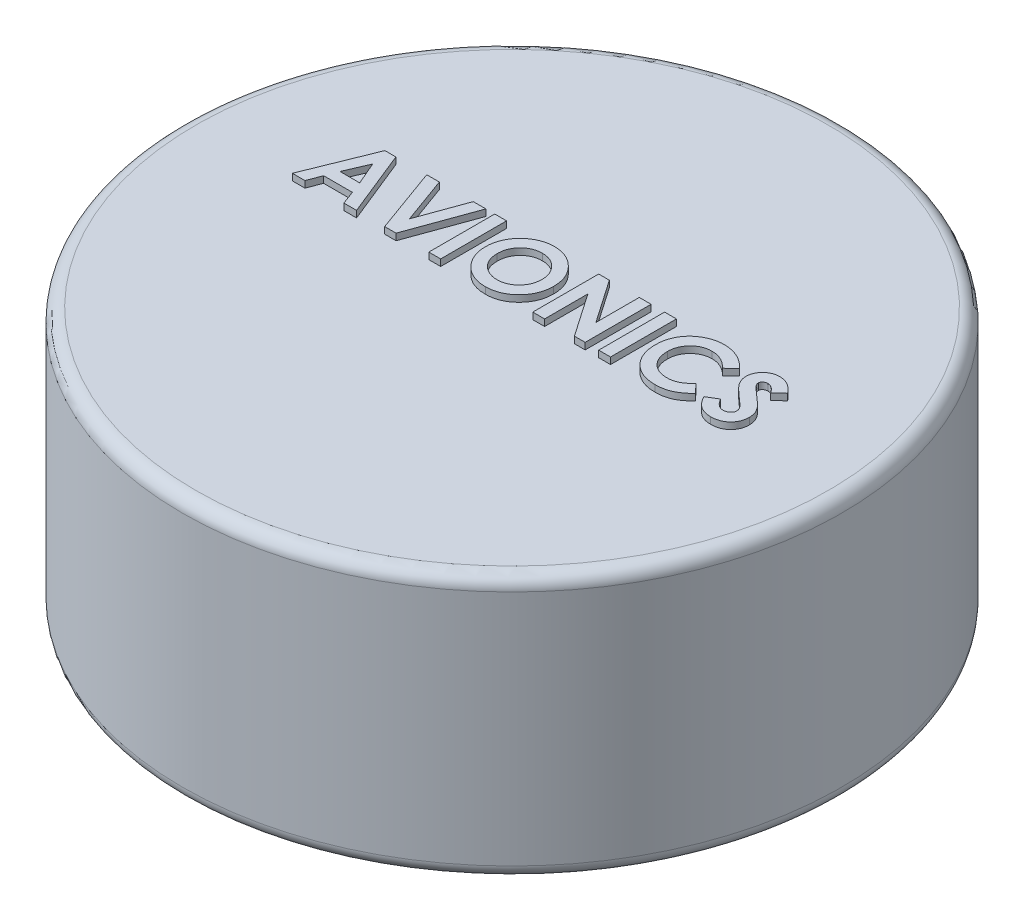
from build123d import *

# Parameters (mm, degrees)
SKETCH1_R           = 63.5
BOSS_EXTRUDE1_DEPTH = 50.8
SKETCH2_W           = 2.27948718
SKETCH2_H           = 12.7
BOSS_EXTRUDE2_DEPTH = 1.27
FILLET1_R           = 2.54
SKETCH3_W           = 6.35
SKETCH3_H           = 1.13974359
CUT_EXTRUDE2_DEPTH  = 0.635


with BuildPart() as part:
    # Sketch1 → Boss-Extrude1 (new body)
    with BuildSketch(Plane(origin=(0, 0, 0), x_dir=(1, 0, 0), z_dir=(0, 1, 0))):
        with Locations(Location((0, 0, 0), (0, 0, 270))):
            Circle(SKETCH1_R)
    extrude(amount=BOSS_EXTRUDE1_DEPTH)

    # Sketch2 → Boss-Extrude2 (add)
    # profile 1 of 8: a face of its own
    with BuildSketch(Plane(origin=(0, 50.8, 0), x_dir=(1, 0, 0), z_dir=(0, 1, 0))):
        with BuildLine():
            Line((42.089102564, 11.003104968), (40.384575321, 9.443589744))
            add(Edge.make_bspline(
                [(40.384575321, 9.443589744), (40.311560682, 9.546584482), (40.171382759, 9.744320015), (39.944168966, 10.009092556), (39.717981161, 10.234963237), (39.490723849, 10.420988475), (39.260382709, 10.566038029), (39.02735758, 10.668734715), (38.792969546, 10.734019974), (38.635496969, 10.742149559), (38.557932692, 10.746153846)],
                knots=[0, 0, 0, 0, 1.299362458, 2.494594718, 3.587462134, 4.587049575, 5.512617175, 6.380583204, 7.202344345, 8, 8, 8, 8], degree=3))
            add(Edge.make_bspline(
                [(38.557932692, 10.746153846), (38.48558296, 10.743616546), (38.345894636, 10.738717687), (38.146758566, 10.690023387), (37.969962727, 10.605984176), (37.815679665, 10.496095839), (37.693464716, 10.363705868), (37.595885558, 10.224862829), (37.540940292, 10.071611514), (37.533708414, 9.966352329), (37.530128205, 9.914242788)],
                knots=[0, 0, 0, 0, 1.185010067, 2.2879431, 3.333075148, 4.379039566, 5.372662701, 6.27520591, 7.14612461, 8, 8, 8, 8], degree=3))
            add(Edge.make_bspline(
                [(37.530128205, 9.914242788), (37.53237174, 9.861381805), (37.536889909, 9.754927131), (37.580529263, 9.598904547), (37.646306232, 9.446452321), (37.709158811, 9.353647397), (37.741286058, 9.306209936)],
                knots=[0, 0, 0, 0, 0.967525499, 1.948461899, 2.951351359, 4, 4, 4, 4], degree=3))
            add(Edge.make_bspline(
                [(37.741286058, 9.306209936), (37.770493201, 9.269337294), (37.837724186, 9.184461342), (37.965919906, 9.050031065), (38.126906807, 8.885342209), (38.326880004, 8.696057941), (38.55753806, 8.475370858), (38.829572273, 8.231956253), (39.135152312, 7.95827586), (39.352351524, 7.767694745), (39.466165865, 7.667828526)],
                knots=[0, 0, 0, 0, 0.473873513, 1.090794244, 1.870441696, 2.795289791, 3.865433203, 5.087734844, 6.473946851, 8, 8, 8, 8], degree=3))
            add(Edge.make_bspline(
                [(39.466165865, 7.667828526), (39.572996997, 7.57537157), (39.77574029, 7.399907476), (40.064203735, 7.150864368), (40.31771506, 6.926806355), (40.539967346, 6.731096071), (40.727591466, 6.561680065), (40.881376193, 6.417748531), (41.003199745, 6.302103551), (41.072449301, 6.232253913), (41.102003205, 6.20244391)],
                knots=[0, 0, 0, 0, 1.543621617, 2.929473131, 4.163658386, 5.240097082, 6.164993805, 6.925417477, 7.541396219, 8, 8, 8, 8], degree=3))
            add(Edge.make_bspline(
                [(41.102003205, 6.20244391), (41.214124555, 6.081104597), (41.429661163, 5.847847825), (41.709782773, 5.486373187), (41.940331919, 5.133500233), (42.11868911, 4.782589088), (42.253391634, 4.428576801), (42.348358699, 4.062781241), (42.405235105, 3.681380074), (42.411549714, 3.421120337), (42.41474359, 3.289483173)],
                knots=[0, 0, 0, 0, 1.206664779, 2.319633467, 3.337109185, 4.282041471, 5.190008762, 6.099243693, 7.03861361, 8, 8, 8, 8], degree=3))
            add(Edge.make_bspline(
                [(42.41474359, 3.289483173), (42.412470271, 3.161218901), (42.408009935, 2.909559625), (42.353379369, 2.541293762), (42.275479389, 2.188847347), (42.155032354, 1.856055497), (42.008232221, 1.537455535), (41.824197052, 1.238010235), (41.608072981, 0.954689087), (41.360361612, 0.692556805), (41.086363423, 0.454689928), (40.792474325, 0.242935216), (40.475820522, 0.068104729), (40.139107455, -0.075855707), (39.782515359, -0.18673596), (39.406469042, -0.2686868), (39.010393315, -0.317872403), (38.739551026, -0.323014174), (38.601181891, -0.325641026)],
                knots=[0, 0, 0, 0, 1.043214005, 2.046824704, 3.02475056, 3.976699089, 4.921714032, 5.875962561, 6.831408892, 7.817874052, 8.806269674, 9.781291748, 10.760897367, 11.74438705, 12.757449933, 13.795994037, 14.874007457, 16, 16, 16, 16], degree=3))
            add(Edge.make_bspline(
                [(38.601181891, -0.325641026), (38.492563299, -0.323714059), (38.277436193, -0.319897561), (37.960371362, -0.28873903), (37.654209426, -0.238452477), (37.359295248, -0.166376823), (37.074300188, -0.075047195), (36.799212542, 0.036508447), (36.535931331, 0.170019174), (36.282464445, 0.322739475), (36.040044045, 0.50006786), (35.805604821, 0.698378911), (35.581475446, 0.920722738), (35.366579472, 1.166573507), (35.162291863, 1.43662741), (34.961925553, 1.727123445), (34.774385424, 2.043452825), (34.658533543, 2.265360444), (34.599358974, 2.378705929)],
                knots=[0, 0, 0, 0, 1.016823716, 2.013894106, 2.979844003, 3.91962641, 4.853723003, 5.779685073, 6.695824784, 7.614987388, 8.547259901, 9.504950863, 10.487499108, 11.500346958, 12.559593716, 13.656357062, 14.802919212, 16, 16, 16, 16], degree=3))
            Line((34.599358974, 2.378705929), (36.604086538, 3.582051282))
            add(Edge.make_bspline(
                [(36.604086538, 3.582051282), (36.67810508, 3.453389346), (36.82000495, 3.206733419), (37.060467545, 2.87531992), (37.306809199, 2.591519116), (37.564725108, 2.360347206), (37.831079112, 2.178713124), (38.107157762, 2.048904809), (38.393155027, 1.968553608), (38.587963371, 1.95874087), (38.685136218, 1.953846154)],
                knots=[0, 0, 0, 0, 1.283663364, 2.460892379, 3.537111102, 4.529833553, 5.449777664, 6.316464042, 7.160231139, 8, 8, 8, 8], degree=3))
            add(Edge.make_bspline(
                [(38.685136218, 1.953846154), (38.783974915, 1.957843445), (38.975736382, 1.965598771), (39.249451337, 2.037232385), (39.500403572, 2.149702414), (39.71732483, 2.310181636), (39.901000075, 2.495399049), (40.036562949, 2.70146189), (40.12172446, 2.92441691), (40.130728097, 3.079296132), (40.13525641, 3.157191506)],
                knots=[0, 0, 0, 0, 1.13588714, 2.203786484, 3.234766741, 4.283437687, 5.291419208, 6.222934724, 7.106237994, 8, 8, 8, 8], degree=3))
            add(Edge.make_bspline(
                [(40.13525641, 3.157191506), (40.131074698, 3.229660476), (40.122579951, 3.37687425), (40.060010259, 3.59575746), (39.962194746, 3.814541127), (39.846472097, 3.993993409), (39.728709811, 4.14424394), (39.616102504, 4.274429229), (39.478976592, 4.418261182), (39.317679767, 4.575920729), (39.134343179, 4.748795786), (38.928812393, 4.936869426), (38.698733862, 5.138484943), (38.536113902, 5.275823442), (38.451081731, 5.347636218)],
                knots=[0, 0, 0, 0, 0.916159276, 1.861089862, 2.860218735, 3.940849679, 4.552606315, 5.27541173, 6.11797699, 7.06649574, 8.129236253, 9.306560635, 10.591630461, 12, 12, 12, 12], degree=3))
            add(Edge.make_bspline(
                [(38.451081731, 5.347636218), (38.289432189, 5.484407231), (37.97917779, 5.746912204), (37.540748961, 6.134623785), (37.145685331, 6.496975782), (36.797399092, 6.83844766), (36.491452538, 7.152733223), (36.229917674, 7.44238522), (36.015667578, 7.709637919), (35.79021555, 8.026180857), (35.575991047, 8.411910177), (35.390840285, 8.875987265), (35.270722285, 9.340005468), (35.257264734, 9.651521732), (35.250641026, 9.804847756)],
                knots=[0, 0, 0, 0, 1.345494975, 2.582412109, 3.71882943, 4.751509156, 5.681369928, 6.505683931, 7.230279997, 7.856715994, 8.973648664, 10.023341002, 11.027102913, 12, 12, 12, 12], degree=3))
            add(Edge.make_bspline(
                [(35.250641026, 9.804847756), (35.253395817, 9.913578343), (35.258823052, 10.127789279), (35.307234826, 10.442755249), (35.379588065, 10.746670946), (35.484665741, 11.038427546), (35.621043878, 11.317659612), (35.786669827, 11.585734105), (35.984115445, 11.840183725), (36.206623328, 12.080839791), (36.451770047, 12.300772049), (36.713740469, 12.494884304), (36.99105182, 12.658834337), (37.282007648, 12.794842794), (37.588410887, 12.898948629), (37.908004276, 12.972744033), (38.241246216, 13.016635186), (38.46791019, 13.022601679), (38.583373397, 13.025641026)],
                knots=[0, 0, 0, 0, 1.010766082, 1.991317756, 2.957454644, 3.913069143, 4.869106762, 5.843196583, 6.838735724, 7.860187025, 8.887984031, 9.89767229, 10.887916223, 11.879572884, 12.879850636, 13.892031539, 14.926195476, 16, 16, 16, 16], degree=3))
            add(Edge.make_bspline(
                [(38.583373397, 13.025641026), (38.733008, 13.020167073), (39.031096042, 13.009262377), (39.47182781, 12.923991221), (39.902316174, 12.789893345), (40.249211765, 12.62811901), (40.525230112, 12.471408136), (40.736772391, 12.327128504), (40.952028047, 12.161848431), (41.172732982, 11.975047075), (41.394786158, 11.763204855), (41.624501608, 11.53136484), (41.858749178, 11.277523391), (42.010972958, 11.096180237), (42.089102564, 11.003104968)],
                knots=[0, 0, 0, 0, 1.282922637, 2.555718331, 3.837320111, 5.142675274, 5.830281639, 6.55870424, 7.337177975, 8.157850921, 9.037902056, 9.96903443, 10.957596896, 12, 12, 12, 12], degree=3))
        make_face()
    # profile 2 of 8: a face of its own
    with BuildSketch(Plane(origin=(0, 50.8, 0), x_dir=(1, 0, 0), z_dir=(0, 1, 0))):
        with BuildLine():
            Line((33.296794872, 10.496834936), (31.625340545, 8.899158654))
            add(Edge.make_bspline(
                [(31.625340545, 8.899158654), (31.483554172, 9.045766001), (31.206600965, 9.332136081), (30.760325124, 9.71126483), (30.296214499, 10.027217344), (29.823297435, 10.29331054), (29.333067525, 10.494629007), (28.831193162, 10.641333165), (28.31446973, 10.730773146), (27.964771187, 10.741006662), (27.788882212, 10.746153846)],
                knots=[0, 0, 0, 0, 1.115251505, 2.178435587, 3.19620269, 4.182487026, 5.141301733, 6.088180966, 7.038406374, 8, 8, 8, 8], degree=3))
            add(Edge.make_bspline(
                [(27.788882212, 10.746153846), (27.641993543, 10.742087391), (27.352124938, 10.734062689), (26.926521867, 10.675233713), (26.519410534, 10.575192477), (26.129397332, 10.437317123), (25.757629893, 10.258913733), (25.403328758, 10.040120387), (25.067367444, 9.782913099), (24.754183804, 9.488622671), (24.467694416, 9.167088264), (24.214562801, 8.824011819), (24.002524468, 8.460179305), (23.828508058, 8.079275349), (23.692956, 7.679536941), (23.596154801, 7.261233199), (23.540167575, 6.823865956), (23.531811106, 6.526546964), (23.527564103, 6.375440705)],
                knots=[0, 0, 0, 0, 1.035432265, 2.043311493, 3.022114605, 3.98653278, 4.95457646, 5.923598177, 6.917315552, 7.932509744, 8.948865224, 9.949768934, 10.933144597, 11.912367597, 12.897413939, 13.903909035, 14.934704909, 16, 16, 16, 16], degree=3))
            add(Edge.make_bspline(
                [(23.527564103, 6.375440705), (23.52878804, 6.26938376), (23.531200447, 6.060343343), (23.557608505, 5.751114549), (23.600131706, 5.451089514), (23.661673313, 5.160722695), (23.738631697, 4.879762458), (23.828921405, 4.605784974), (23.942188516, 4.342575994), (24.067916718, 4.087078518), (24.214137168, 3.846264113), (24.371789787, 3.616627591), (24.542738313, 3.39929461), (24.728089989, 3.195153631), (24.930453411, 3.007394922), (25.144598231, 2.830372355), (25.374136777, 2.668517404), (25.614300952, 2.517768141), (25.86716547, 2.386810973), (26.125869532, 2.26818908), (26.394335611, 2.171850466), (26.669294972, 2.094192754), (26.949765007, 2.028156468), (27.238488974, 1.987495897), (27.532963998, 1.956704123), (27.731979686, 1.954802911), (27.83213141, 1.953846154)],
                knots=[0, 0, 0, 0, 1.103660481, 2.175337485, 3.227646561, 4.255952547, 5.262355991, 6.258840057, 7.255597736, 8.242457506, 9.22035537, 10.185017736, 11.140346927, 12.096287581, 13.051739095, 14.01125915, 14.986044842, 15.97314143, 16.960198552, 17.947847494, 18.933482797, 19.925264591, 20.920966487, 21.929612487, 22.958107872, 24, 24, 24, 24], degree=3))
            add(Edge.make_bspline(
                [(27.83213141, 1.953846154), (28.002005946, 1.958759827), (28.335765235, 1.968413917), (28.825604981, 2.043907532), (29.292373459, 2.168090257), (29.66531924, 2.314742839), (29.957512408, 2.459564168), (30.179954748, 2.593516765), (30.409977464, 2.743357453), (30.643760076, 2.91474138), (30.883932175, 3.105611871), (31.126254169, 3.320149346), (31.376929544, 3.551289394), (31.541144498, 3.716258587), (31.625340545, 3.800841346)],
                knots=[0, 0, 0, 0, 1.404581149, 2.759636711, 4.088442092, 5.392261763, 6.066678138, 6.783632037, 7.538459478, 8.336747902, 9.180226004, 10.074962426, 11.012997595, 12, 12, 12, 12], degree=3))
            Line((31.625340545, 3.800841346), (33.245913462, 2.098858173))
            add(Edge.make_bspline(
                [(33.245913462, 2.098858173), (33.131995908, 1.988874352), (32.909653207, 1.774209454), (32.574255413, 1.469405329), (32.239279732, 1.19550494), (31.912818476, 0.942566902), (31.58952387, 0.717959914), (31.2694302, 0.521459659), (30.956161065, 0.348096362), (30.643211331, 0.200793709), (30.328633663, 0.075718457), (30.004970211, -0.031963125), (29.671231506, -0.12305787), (29.325379222, -0.196559365), (28.97063926, -0.255497641), (28.603691725, -0.295280637), (28.226863245, -0.322025422), (27.971254649, -0.324428662), (27.842307692, -0.325641026)],
                knots=[0, 0, 0, 0, 1.244526981, 2.429050516, 3.560637417, 4.644440555, 5.67424972, 6.652764056, 7.595344123, 8.486817594, 9.369275933, 10.254498637, 11.166417451, 12.086725134, 13.032340136, 13.991389299, 14.986715468, 16, 16, 16, 16], degree=3))
            add(Edge.make_bspline(
                [(27.842307692, -0.325641026), (27.605448106, -0.319603002), (27.141979735, -0.307788269), (26.462778921, -0.220249097), (25.81755638, -0.073491216), (25.204742406, 0.134064907), (24.624531859, 0.399208127), (24.077073176, 0.724261264), (23.563248738, 1.108360704), (23.087209235, 1.547004428), (22.656608848, 2.031449597), (22.276007973, 2.551610806), (21.961174914, 3.110044456), (21.699762242, 3.698500699), (21.49534097, 4.319664889), (21.35146305, 4.974208936), (21.262734586, 5.661500838), (21.253027566, 6.13093705), (21.248076923, 6.370352564)],
                knots=[0, 0, 0, 0, 1.078019885, 2.10938526, 3.111377082, 4.085535484, 5.04941344, 6.010039228, 6.978205633, 7.964457913, 8.951525778, 9.924444315, 10.892603023, 11.863865945, 12.85144698, 13.863884204, 14.910567087, 16, 16, 16, 16], degree=3))
            add(Edge.make_bspline(
                [(21.248076923, 6.370352564), (21.250168825, 6.526497319), (21.254314463, 6.835938061), (21.297885505, 7.291769345), (21.35862607, 7.73612331), (21.454985454, 8.164386091), (21.571137188, 8.582327176), (21.715587129, 8.985404036), (21.888104572, 9.374775152), (22.083128872, 9.751092356), (22.303757912, 10.111890367), (22.55022477, 10.454069362), (22.816184429, 10.780270898), (23.108027464, 11.086167307), (23.421513016, 11.37444442), (23.758056435, 11.643540007), (24.11563358, 11.897313202), (24.495212281, 12.129219811), (24.889418333, 12.338991665), (25.293279762, 12.5240194), (25.705804327, 12.678659977), (26.125247837, 12.806928632), (26.553382434, 12.902672113), (26.987152204, 12.975146839), (27.430248006, 13.015660675), (27.727748451, 13.022293048), (27.877924679, 13.025641026)],
                knots=[0, 0, 0, 0, 1.071919942, 2.124283339, 3.142214191, 4.149696895, 5.136002878, 6.119640489, 7.086990633, 8.058538607, 9.028339693, 9.988281803, 10.952401235, 11.916291999, 12.888973767, 13.874849856, 14.873389453, 15.898127285, 16.927174885, 17.938320013, 18.946391617, 19.950418109, 20.947802303, 21.956882652, 22.968648068, 24, 24, 24, 24], degree=3))
            add(Edge.make_bspline(
                [(27.877924679, 13.025641026), (28.006040401, 13.023721881), (28.260939796, 13.019903546), (28.64052777, 12.988073571), (29.017079977, 12.938084917), (29.389248245, 12.862662682), (29.759694702, 12.773126959), (30.123551265, 12.655892281), (30.486557969, 12.525212138), (30.843021593, 12.369010711), (31.193439709, 12.198502744), (31.529603219, 12.005055263), (31.857156278, 11.80057281), (32.168840506, 11.572953218), (32.470494422, 11.330452672), (32.760540649, 11.071939772), (33.036433862, 10.793104348), (33.209569124, 10.596090662), (33.296794872, 10.496834936)],
                knots=[0, 0, 0, 0, 0.996412454, 1.982464992, 2.961075852, 3.949442424, 4.934965278, 5.923860011, 6.921385422, 7.934793307, 8.949617135, 9.951082467, 10.950285876, 11.951772932, 12.951063433, 13.960125323, 14.972308753, 16, 16, 16, 16], degree=3))
        make_face()
    # profile 3 of 8: a face of its own
    with BuildSketch(Plane(origin=(0, 50.8, 0), x_dir=(1, 0, 0), z_dir=(0, 1, 0))):
        with Locations((17.828846154, 6.35)):
            Rectangle(SKETCH2_W, SKETCH2_H)
    # profile 4 of 8: a face of its own
    with BuildSketch(Plane(origin=(0, 50.8, 0), x_dir=(1, 0, 0), z_dir=(0, 1, 0))):
        Polygon((3.989102564, 12.7), (6.042167468, 12.7), (11.804487179, 4.342728365), (11.804487179, 12.7), (14.083974359, 12.7), (14.083974359, 0), (12.015645032, 0), (6.268589744, 8.331830929), (6.268589744, 0), (3.989102564, 0), align=None)
    # profile 5 of 8: a face of its own
    with BuildSketch(Plane(origin=(0, 50.8, 0), x_dir=(1, 0, 0), z_dir=(0, 1, 0))):
        with BuildLine():
            add(Edge.make_bspline(
                [(-4.859174679, 13.025641026), (-4.638369615, 13.019923987), (-4.202450406, 13.008637258), (-3.561370556, 12.914553563), (-2.943571586, 12.761257671), (-2.349332862, 12.548165293), (-1.78014229, 12.269504804), (-1.233992143, 11.933176413), (-0.712838706, 11.532832122), (-0.222022342, 11.077811304), (0.231580499, 10.582996032), (0.624627626, 10.050239421), (0.959803796, 9.493345729), (1.237598703, 8.910822743), (1.449191231, 8.298636215), (1.597674459, 7.659907486), (1.693067577, 6.994818269), (1.704039254, 6.541983165), (1.709615385, 6.311838942)],
                knots=[0, 0, 0, 0, 1.014329547, 2.002516266, 2.970391464, 3.935626869, 4.897733899, 5.877609409, 6.878433252, 7.912639331, 8.949961323, 9.958554974, 10.949718813, 11.932905612, 12.9188844, 13.919928257, 14.942845884, 16, 16, 16, 16], degree=3))
            add(Edge.make_bspline(
                [(1.709615385, 6.311838942), (1.703677046, 6.084287913), (1.69197536, 5.63589131), (1.601568824, 4.976931152), (1.450585119, 4.345044539), (1.242581367, 3.73880118), (0.969824609, 3.161137512), (0.641184739, 2.608365231), (0.247989575, 2.085614197), (-0.195419512, 1.593164938), (-0.683574435, 1.146161568), (-1.200607993, 0.752240619), (-1.744132843, 0.418446873), (-2.313353439, 0.144933223), (-2.909490447, -0.067330648), (-3.531071335, -0.217098233), (-4.178057641, -0.308115018), (-4.618039704, -0.31974027), (-4.841366186, -0.325641026)],
                knots=[0, 0, 0, 0, 1.051557043, 2.072126891, 3.067553643, 4.050577992, 5.02905126, 6.015227836, 7.017913613, 8.04756643, 9.074058332, 10.072836633, 11.047628519, 12.017157415, 12.98668631, 13.966869689, 14.968021931, 16, 16, 16, 16], degree=3))
            add(Edge.make_bspline(
                [(-4.841366186, -0.325641026), (-5.074938908, -0.320347757), (-5.533877381, -0.309947208), (-6.20553589, -0.211042731), (-6.849042778, -0.062058038), (-7.458992217, 0.160293622), (-8.041596019, 0.438251895), (-8.592573625, 0.780574173), (-9.111739868, 1.186694741), (-9.596116727, 1.646212702), (-10.034963335, 2.149026138), (-10.422331546, 2.680203945), (-10.749085225, 3.23568839), (-11.015236328, 3.815739453), (-11.225059165, 4.416752257), (-11.373065337, 5.042387144), (-11.460496115, 5.691143613), (-11.472674715, 6.131791976), (-11.478846154, 6.355088141)],
                knots=[0, 0, 0, 0, 1.067978421, 2.098431617, 3.099715153, 4.085208694, 5.062210972, 6.048429807, 7.046490867, 8.072918869, 9.098532598, 10.095778865, 11.076610158, 12.041847152, 13.011192615, 13.984257998, 14.978533688, 16, 16, 16, 16], degree=3))
            add(Edge.make_bspline(
                [(-11.478846154, 6.355088141), (-11.476909201, 6.505310111), (-11.473059821, 6.803851896), (-11.426689983, 7.246275583), (-11.359930749, 7.680063753), (-11.261197009, 8.103486887), (-11.141260751, 8.519532039), (-10.985866385, 8.924326556), (-10.808985544, 9.322194758), (-10.602316936, 9.708437323), (-10.372521426, 10.079500496), (-10.121794065, 10.433633908), (-9.849504403, 10.766555568), (-9.556529576, 11.080453301), (-9.241859951, 11.373263833), (-8.909634683, 11.649132305), (-8.553410536, 11.90073067), (-8.18098414, 12.134203462), (-7.794455147, 12.345328858), (-7.395397083, 12.525032482), (-6.992031331, 12.681964595), (-6.57896947, 12.805822358), (-6.160638191, 12.90670321), (-5.732568472, 12.973417449), (-5.29862768, 13.019786002), (-5.00600665, 13.023684719), (-4.859174679, 13.025641026)],
                knots=[0, 0, 0, 0, 1.034744296, 2.056386356, 3.06226378, 4.057406941, 5.050368692, 6.043467995, 7.042652155, 8.049140477, 9.059438543, 10.048523776, 11.036952808, 12.020949711, 13.004946614, 13.997082645, 14.994316842, 16.007702937, 17.024872941, 18.026463647, 19.021641123, 20.005082605, 20.995858141, 21.984425357, 22.988620895, 24, 24, 24, 24], degree=3))
        make_face()
        with BuildLine():
            add(Edge.make_bspline(
                [(-4.894791667, 10.746153846), (-5.043393446, 10.742166527), (-5.336673893, 10.734297154), (-5.766862898, 10.674343176), (-6.179859535, 10.578589859), (-6.573374401, 10.439892349), (-6.949113022, 10.26336562), (-7.307741467, 10.049626478), (-7.644293474, 9.79132788), (-7.963256639, 9.502336724), (-8.251387371, 9.180334163), (-8.505959963, 8.835253657), (-8.718996219, 8.467671483), (-8.897415419, 8.081002395), (-9.031725532, 7.6708984), (-9.127390599, 7.240571887), (-9.18784735, 6.789281382), (-9.195467999, 6.481637233), (-9.199358974, 6.324559295)],
                knots=[0, 0, 0, 0, 1.033739768, 2.040188636, 3.016340934, 3.979330865, 4.937572243, 5.900995986, 6.878200029, 7.884839167, 8.891893314, 9.879764717, 10.863503415, 11.843163062, 12.837761627, 13.859916423, 14.907309254, 16, 16, 16, 16], degree=3))
            add(Edge.make_bspline(
                [(-9.199358974, 6.324559295), (-9.194200135, 6.150481605), (-9.184089665, 5.809318177), (-9.112951169, 5.311638161), (-8.991240284, 4.841628779), (-8.815492131, 4.401588779), (-8.597518314, 3.986631846), (-8.326829428, 3.601843866), (-8.007809352, 3.24492091), (-7.762038869, 3.036534421), (-7.637299679, 2.930769231)],
                knots=[0, 0, 0, 0, 1.078454662, 2.113592447, 3.107694534, 4.079536787, 5.043276885, 6.005368276, 6.987637804, 8, 8, 8, 8], degree=3))
            add(Edge.make_bspline(
                [(-7.637299679, 2.930769231), (-7.535114469, 2.85263397), (-7.333046298, 2.698123851), (-7.010501503, 2.500087435), (-6.678343876, 2.330350472), (-6.334066872, 2.193205013), (-5.978397585, 2.085328701), (-5.61138479, 2.009784693), (-5.233548511, 1.962374295), (-4.978037913, 1.956707854), (-4.848998397, 1.953846154)],
                knots=[0, 0, 0, 0, 1.023928204, 2.024787132, 3.009472467, 3.9914905, 4.972207045, 5.96565515, 6.972602802, 8, 8, 8, 8], degree=3))
            add(Edge.make_bspline(
                [(-4.848998397, 1.953846154), (-4.702951829, 1.957867281), (-4.415600613, 1.965778976), (-3.993419809, 2.024994887), (-3.588957776, 2.12520959), (-3.199703579, 2.262690396), (-2.826779654, 2.441433571), (-2.472008582, 2.66180223), (-2.134768352, 2.921090531), (-1.816211542, 3.213876773), (-1.52503556, 3.537147801), (-1.270994208, 3.884068932), (-1.051184464, 4.246996453), (-0.876475495, 4.631067054), (-0.736859092, 5.032655287), (-0.642345404, 5.453539702), (-0.58137793, 5.891985252), (-0.573755134, 6.190362942), (-0.569871795, 6.342367788)],
                knots=[0, 0, 0, 0, 1.026359118, 2.019393844, 2.989460624, 3.950973911, 4.916101784, 5.890408035, 6.881132271, 7.902007068, 8.92769091, 9.933912415, 10.920395702, 11.90457117, 12.894218921, 13.903490204, 14.931958862, 16, 16, 16, 16], degree=3))
            add(Edge.make_bspline(
                [(-0.569871795, 6.342367788), (-0.573889499, 6.493498565), (-0.581797735, 6.790976449), (-0.64111787, 7.228294758), (-0.740697037, 7.647321091), (-0.878590684, 8.048739762), (-1.054673569, 8.432944311), (-1.272417919, 8.798583647), (-1.531059697, 9.145304286), (-1.824646278, 9.470743459), (-2.144197228, 9.769801214), (-2.487267101, 10.029328981), (-2.844256418, 10.25485036), (-3.223356255, 10.431514702), (-3.616810548, 10.572262808), (-4.027020175, 10.675911733), (-4.45553883, 10.733875974), (-4.747068932, 10.742024742), (-4.894791667, 10.746153846)],
                knots=[0, 0, 0, 0, 1.055025985, 2.07665775, 3.074803781, 4.057872707, 5.035505728, 6.020516407, 7.023567878, 8.050795229, 9.077271434, 10.074415901, 11.050397877, 12.019801805, 12.988065821, 13.964604439, 14.968634123, 16, 16, 16, 16], degree=3))
        make_face(mode=Mode.SUBTRACT)
    # profile 6 of 8: a face of its own
    with BuildSketch(Plane(origin=(0, 50.8, 0), x_dir=(1, 0, 0), z_dir=(0, 1, 0))):
        with Locations((-14.898076923, 6.35)):
            Rectangle(SKETCH2_W, SKETCH2_H)
    # profile 7 of 8: a face of its own
    with BuildSketch(Plane(origin=(0, 50.8, 0), x_dir=(1, 0, 0), z_dir=(0, 1, 0))):
        Polygon((-29.144871795, 12.7), (-26.710196314, 12.7), (-23.446153846, 3.678725962), (-20.174479167, 12.7), (-17.747435897, 12.7), (-22.352203526, 0), (-24.547736378, 0), align=None)
    # profile 8 of 8: a face of its own
    with BuildSketch(Plane(origin=(0, 50.8, 0), x_dir=(1, 0, 0), z_dir=(0, 1, 0))):
        Polygon((-37.201943109, 12.7), (-35.087820513, 12.7), (-29.958974359, 0), (-32.39364984, 0), (-33.380749199, 2.605128205), (-38.914102564, 2.605128205), (-39.901201923, 0), (-42.333333333, 0), align=None)
        Polygon((-36.146153846, 9.293489583), (-38.04911859, 4.884615385), (-34.243189103, 4.884615385), align=None, mode=Mode.SUBTRACT)
    extrude(amount=BOSS_EXTRUDE2_DEPTH)

    # Fillet1
    fillet1_edges = [part.edges().sort_by_distance(p)[0] for p in [
        (0, 0, -63.5),
        (0, 50.8, -63.5),
    ]]
    fillet(fillet1_edges, radius=FILLET1_R)

    # Sketch3 → Cut-Extrude2 (cut, symmetric)
    # profile 1 of 8: a face of its own
    with BuildSketch(Plane.XY):
        Polygon((-6.35, 6.636207933), (-6.35, 7.693269231), (0, 10.257692308), (0, 9.040354567), (-1.302564103, 8.546804888), (-1.302564103, 5.780128205), (0, 5.286578526), (0, 4.070512821), align=None)
        Polygon((-4.646744792, 7.164102564), (-2.442307692, 6.212620192), (-2.442307692, 8.115584936), align=None, mode=Mode.SUBTRACT)
    # profile 2 of 8: a face of its own
    with BuildSketch(Plane.XY):
        Polygon((-6.35, 10.66474359), (-6.35, 11.88208133), (-1.839362981, 13.514102564), (-6.35, 15.149939904), (-6.35, 16.363461538), (0, 14.061077724), (0, 12.963311298), align=None)
    # profile 3 of 8: a face of its own
    with BuildSketch(Plane.XY):
        with Locations((-3.175, 17.788141026)):
            Rectangle(SKETCH3_W, SKETCH3_H)
    # profile 4 of 8: a face of its own
    with BuildSketch(Plane.XY):
        with BuildLine():
            add(Edge.make_bspline(
                [(-6.512820513, 22.807592147), (-6.509961437, 22.917994338), (-6.504316975, 23.135953267), (-6.457283145, 23.456498122), (-6.380605528, 23.765379361), (-6.274169342, 24.06256637), (-6.134525516, 24.346708957), (-5.968077246, 24.62057645), (-5.76758958, 24.880700165), (-5.540203034, 25.12618142), (-5.292769118, 25.352978369), (-5.026371704, 25.549447915), (-4.747695477, 25.717449105), (-4.455684313, 25.855661465), (-4.149342642, 25.961827315), (-3.829947006, 26.036002378), (-3.497410901, 26.083717034), (-3.270992178, 26.08920038), (-3.155919471, 26.091987179)],
                knots=[0, 0, 0, 0, 1.014235534, 2.002330665, 2.970116157, 3.9352621, 4.897279957, 5.875024536, 6.875755618, 7.909865842, 8.947091691, 9.955591861, 10.946663836, 11.933282567, 12.91916997, 13.920121047, 14.942943865, 16, 16, 16, 16], degree=3))
            add(Edge.make_bspline(
                [(-3.155919471, 26.091987179), (-3.042143723, 26.089018395), (-2.817944962, 26.083168311), (-2.488468227, 26.037959527), (-2.172512643, 25.962487923), (-1.869435994, 25.858411784), (-1.580766547, 25.722464691), (-1.30529935, 25.55733785), (-1.043979154, 25.361291769), (-0.797907088, 25.139023729), (-0.573025107, 24.895840921), (-0.37614274, 24.636830994), (-0.209350828, 24.365080712), (-0.071998958, 24.080802907), (0.031612823, 23.781949067), (0.109092273, 23.471892641), (0.153911975, 23.14811182), (0.159821136, 22.928146556), (0.162820513, 22.816496394)],
                knots=[0, 0, 0, 0, 1.051628416, 2.072267533, 3.067761847, 4.050852917, 5.029392597, 6.012272624, 7.015026456, 8.044749159, 9.073964344, 10.072810436, 11.047668484, 12.017263184, 12.98554948, 13.966731695, 14.967951888, 16, 16, 16, 16], degree=3))
            add(Edge.make_bspline(
                [(0.162820513, 22.816496394), (0.160161134, 22.699714913), (0.154935818, 22.470255265), (0.105664628, 22.134356685), (0.030544137, 21.812995483), (-0.078212258, 21.507052197), (-0.219526053, 21.216764664), (-0.390151676, 20.940831067), (-0.593384995, 20.681326671), (-0.823096149, 20.439116482), (-1.074515719, 20.219699025), (-1.340101283, 20.026013401), (-1.617844375, 19.862636956), (-1.907869679, 19.729561301), (-2.208376142, 19.62464991), (-2.521193568, 19.550646817), (-2.845571808, 19.50693143), (-3.065895988, 19.50084213), (-3.177544071, 19.49775641)],
                knots=[0, 0, 0, 0, 1.067953136, 2.098381936, 3.099641766, 4.083805132, 5.062469929, 6.048665414, 7.046702845, 8.073106546, 9.098695993, 10.09591865, 11.076726721, 12.041940862, 13.011263376, 13.984305721, 14.978557872, 16, 16, 16, 16], degree=3))
            add(Edge.make_bspline(
                [(-3.177544071, 19.49775641), (-3.252654947, 19.49872517), (-3.401925624, 19.500650423), (-3.62313906, 19.523831182), (-3.840027222, 19.557226276), (-4.051760609, 19.606536131), (-4.260083584, 19.666826584), (-4.46314022, 19.743918267), (-4.66230756, 19.832799928), (-4.855353343, 19.935564015), (-5.040053977, 20.051739256), (-5.217997306, 20.175802484), (-5.384526435, 20.312477671), (-5.54141749, 20.458971604), (-5.688069503, 20.615773962), (-5.82433003, 20.783200849), (-5.951758551, 20.960049676), (-6.068663399, 21.146336704), (-6.172000452, 21.340684079), (-6.264539326, 21.538803189), (-6.340505512, 21.741517335), (-6.403051125, 21.947638527), (-6.453314115, 22.156875454), (-6.486718886, 22.370891168), (-6.509890423, 22.587866683), (-6.511841498, 22.734176508), (-6.512820513, 22.807592147)],
                knots=[0, 0, 0, 0, 1.034634222, 2.056167603, 3.061938024, 4.056975325, 5.049831446, 6.048294015, 7.047371884, 8.053753139, 9.058980286, 10.052730068, 11.041053953, 12.024946181, 13.008838409, 13.997162294, 14.997691456, 16.01096975, 17.025258359, 18.029177048, 19.022170708, 20.005507574, 20.996177714, 21.984639769, 22.988728483, 24, 24, 24, 24], degree=3))
        make_face()
        with BuildLine():
            add(Edge.make_bspline(
                [(-5.373076923, 22.789783654), (-5.371083263, 22.715482764), (-5.367148577, 22.568842541), (-5.337171588, 22.353748038), (-5.289294929, 22.147249719), (-5.219946174, 21.950492287), (-5.13168281, 21.762622976), (-5.024813239, 21.583308753), (-4.89566394, 21.41503275), (-4.751168362, 21.255551168), (-4.590167082, 21.111485801), (-4.417626828, 20.984199505), (-4.233835742, 20.877681377), (-4.040501198, 20.788471778), (-3.8354492, 20.721316721), (-3.620285943, 20.673484188), (-3.394640691, 20.643255812), (-3.240818616, 20.639445488), (-3.162279647, 20.6375)],
                knots=[0, 0, 0, 0, 1.033739768, 2.040188636, 3.016340934, 3.979330865, 4.937572243, 5.900995986, 6.878200029, 7.884839167, 8.891893314, 9.879764717, 10.863503415, 11.843163062, 12.837761627, 13.859916423, 14.907309254, 16, 16, 16, 16], degree=3))
            add(Edge.make_bspline(
                [(-3.162279647, 20.6375), (-3.075243317, 20.640085338), (-2.904666532, 20.645152172), (-2.655791165, 20.680638201), (-2.420531053, 20.741892551), (-2.200054312, 20.828759246), (-1.993119208, 20.938854266), (-1.80089187, 21.073705234), (-1.622468307, 21.233290362), (-1.518269854, 21.356165288), (-1.465384615, 21.418529647)],
                knots=[0, 0, 0, 0, 1.078420897, 2.113526272, 3.107597235, 4.084297302, 5.043369457, 6.005430726, 6.9876695, 8, 8, 8, 8], degree=3))
            add(Edge.make_bspline(
                [(-1.465384615, 21.418529647), (-1.426316985, 21.469622253), (-1.349061925, 21.570656338), (-1.250043717, 21.731928736), (-1.165175236, 21.898007549), (-1.096602506, 22.070146051), (-1.04266435, 22.247980694), (-1.004892346, 22.431487092), (-0.981187147, 22.620405231), (-0.978353927, 22.748160531), (-0.976923077, 22.812680288)],
                knots=[0, 0, 0, 0, 1.023928204, 2.024787132, 3.009472467, 3.9914905, 4.972207045, 5.96565515, 6.972602802, 8, 8, 8, 8], degree=3))
            add(Edge.make_bspline(
                [(-0.976923077, 22.812680288), (-0.9789366, 22.885702077), (-0.982898269, 23.029374743), (-1.012463971, 23.240486499), (-1.06272676, 23.442638961), (-1.130954225, 23.637730522), (-1.222493598, 23.823057119), (-1.330638324, 24.001566956), (-1.460626186, 24.170148047), (-1.608166411, 24.328738853), (-1.769733465, 24.474203353), (-1.942330394, 24.602530515), (-2.124351228, 24.710800874), (-2.315765858, 24.799330217), (-2.516363915, 24.868677976), (-2.726759904, 24.916026521), (-2.945995245, 24.946485326), (-3.095182355, 24.950300166), (-3.171183894, 24.95224359)],
                knots=[0, 0, 0, 0, 1.026460056, 2.019592442, 2.989754624, 3.951362471, 4.919177453, 5.890456226, 6.881277895, 7.906300149, 8.932084862, 9.933608786, 10.925308803, 11.904168404, 12.893913482, 13.903284022, 14.931853825, 16, 16, 16, 16], degree=3))
            add(Edge.make_bspline(
                [(-3.171183894, 24.95224359), (-3.246751168, 24.950239831), (-3.395493823, 24.946295738), (-3.614126015, 24.916562859), (-3.823347476, 24.867132959), (-4.023697526, 24.797272713), (-4.216227988, 24.710241382), (-4.399267862, 24.600915542), (-4.572658787, 24.471664885), (-4.735369931, 24.324852221), (-4.884901074, 24.165081945), (-5.01466437, 23.99354566), (-5.127425212, 23.815051351), (-5.215757342, 23.62550134), (-5.286131406, 23.428774218), (-5.337955866, 23.223669398), (-5.366937987, 23.009410072), (-5.371012371, 22.863645021), (-5.373076923, 22.789783654)],
                knots=[0, 0, 0, 0, 1.055040155, 2.076685641, 3.074845078, 4.052329834, 5.035358467, 6.020382375, 7.023447318, 8.050688466, 9.077178457, 10.074336316, 11.0503314, 12.019748348, 12.988025369, 13.964577102, 14.968620271, 16, 16, 16, 16], degree=3))
        make_face(mode=Mode.SUBTRACT)
    # profile 5 of 8: a face of its own
    with BuildSketch(Plane.XY):
        Polygon((-6.35, 27.231730769), (-6.35, 28.258263221), (-2.171364183, 31.139423077), (-6.35, 31.139423077), (-6.35, 32.279166667), (0, 32.279166667), (0, 31.245002003), (-4.165915465, 28.371474359), (0, 28.371474359), (0, 27.231730769), align=None)
    # profile 6 of 8: a face of its own
    with BuildSketch(Plane.XY):
        with Locations((-3.175, 34.151602564)):
            Rectangle(SKETCH3_W, SKETCH3_H)
    # profile 7 of 8: a face of its own
    with BuildSketch(Plane.XY):
        with BuildLine():
            Line((-5.248417468, 41.885576923), (-4.449579327, 41.04984976))
            add(Edge.make_bspline(
                [(-4.449579327, 41.04984976), (-4.522895703, 40.978963176), (-4.666105554, 40.840499469), (-4.855493013, 40.617269587), (-5.013985072, 40.385711719), (-5.144788229, 40.14813648), (-5.247741534, 39.904078901), (-5.32054082, 39.65272047), (-5.365418499, 39.394428467), (-5.370514015, 39.219569804), (-5.373076923, 39.131620593)],
                knots=[0, 0, 0, 0, 1.115315123, 2.178559852, 3.196385012, 4.180486591, 5.141138664, 6.08807191, 7.038351522, 8, 8, 8, 8], degree=3))
            add(Edge.make_bspline(
                [(-5.373076923, 39.131620593), (-5.371046151, 39.058175093), (-5.367038647, 38.913238492), (-5.337588891, 38.700453689), (-5.287697198, 38.496836855), (-5.218348107, 38.302226445), (-5.131014348, 38.115660286), (-5.02124211, 37.938875637), (-4.892695174, 37.770922441), (-4.745598481, 37.613763092), (-4.583695319, 37.471882195), (-4.413182266, 37.344045491), (-4.231043361, 37.238159237), (-4.039934745, 37.151724408), (-3.839787409, 37.083611775), (-3.630611371, 37.035269507), (-3.41193435, 37.007259964), (-3.263273944, 37.003083925), (-3.187720353, 37.000961538)],
                knots=[0, 0, 0, 0, 1.035268443, 2.04298821, 3.02163646, 3.985902049, 4.951223231, 5.920091634, 6.913651787, 7.92868536, 8.949353712, 9.945284791, 10.92850487, 11.913014323, 12.897904816, 13.904240668, 14.934873455, 16, 16, 16, 16], degree=3))
            add(Edge.make_bspline(
                [(-3.187720353, 37.000961538), (-3.134693381, 37.001582698), (-3.030176129, 37.002807015), (-2.875958705, 37.015843617), (-2.726025684, 37.037553893), (-2.580737413, 37.067796458), (-2.439904183, 37.106564918), (-2.303196221, 37.151349172), (-2.172243492, 37.208550095), (-2.044594077, 37.271470357), (-1.92332076, 37.343858143), (-1.808343696, 37.42312299), (-1.69963715, 37.508534395), (-1.597587645, 37.601233036), (-1.503664253, 37.702386191), (-1.415309568, 37.809550858), (-1.333917294, 37.923791633), (-1.260783544, 38.045154305), (-1.192615135, 38.169966305), (-1.136165135, 38.300798911), (-1.085419313, 38.43399249), (-1.047243335, 38.571884693), (-1.01403826, 38.712046291), (-0.993758897, 38.856428274), (-0.97834926, 39.003660386), (-0.977400518, 39.103168962), (-0.976923077, 39.153245192)],
                knots=[0, 0, 0, 0, 1.103738238, 2.175490744, 3.219137561, 4.256155604, 5.262629953, 6.259184223, 7.247888397, 8.234817694, 9.220364322, 10.185094651, 11.140491148, 12.096499151, 13.05201798, 14.011605636, 14.986460005, 15.968997565, 16.960259839, 17.944382265, 18.933125845, 19.924977513, 20.920749559, 21.929466621, 22.958034467, 24, 24, 24, 24], degree=3))
            add(Edge.make_bspline(
                [(-0.976923077, 39.153245192), (-0.979370641, 39.23818587), (-0.984179467, 39.405072214), (-1.022058376, 39.649943509), (-1.0837038, 39.883657646), (-1.158603579, 40.06971951), (-1.231229537, 40.21557751), (-1.296517029, 40.327548314), (-1.37178311, 40.442106464), (-1.457340318, 40.559077494), (-1.552814809, 40.679140325), (-1.660072121, 40.800308081), (-1.775645387, 40.925643851), (-1.858129527, 41.007751598), (-1.900420673, 41.04984976)],
                knots=[0, 0, 0, 0, 1.404693586, 2.759857621, 4.088769373, 5.395275838, 6.0697462, 6.783214465, 7.53810233, 8.336454657, 9.18000028, 10.074808326, 11.012918585, 12, 12, 12, 12], degree=3))
            Line((-1.900420673, 41.04984976), (-1.049429087, 41.860136218))
            add(Edge.make_bspline(
                [(-1.049429087, 41.860136218), (-0.994437176, 41.803177441), (-0.887104727, 41.69200609), (-0.734702665, 41.524307194), (-0.59775247, 41.356819353), (-0.471283451, 41.193588725), (-0.358979957, 41.031941422), (-0.26072983, 40.871894587), (-0.174048181, 40.715260019), (-0.100396854, 40.558785152), (-0.037859228, 40.401496319), (0.015981563, 40.239664593), (0.061528935, 40.07279524), (0.098279682, 39.899869098), (0.127748821, 39.722499117), (0.147640319, 39.539025349), (0.161012711, 39.35061111), (0.162214331, 39.222806812), (0.162820513, 39.158333333)],
                knots=[0, 0, 0, 0, 1.244526981, 2.429050516, 3.560637417, 4.644440555, 5.67424972, 6.652764056, 7.595344123, 8.486817594, 9.369275933, 10.254498637, 11.166417451, 12.086725134, 13.032340136, 13.991389299, 14.986715468, 16, 16, 16, 16], degree=3))
            add(Edge.make_bspline(
                [(0.162820513, 39.158333333), (0.159801501, 39.03990354), (0.153894135, 38.808169355), (0.110124548, 38.468568948), (0.036745608, 38.145957677), (-0.067032454, 37.83955069), (-0.199604063, 37.549445417), (-0.362130632, 37.275716075), (-0.554180352, 37.018803856), (-0.773502214, 36.780784104), (-1.015724798, 36.565483911), (-1.275805403, 36.375183474), (-1.555022228, 36.217766944), (-1.84925035, 36.087060608), (-2.159832444, 35.984849972), (-2.487104468, 35.912911012), (-2.830750419, 35.86854678), (-3.065468525, 35.86369327), (-3.185176282, 35.861217949)],
                knots=[0, 0, 0, 0, 1.078019885, 2.10938526, 3.111377082, 4.085535484, 5.04941344, 6.010039228, 6.978205633, 7.964457913, 8.951525778, 9.924444315, 10.892603023, 11.863865945, 12.85144698, 13.863884204, 14.910567087, 16, 16, 16, 16], degree=3))
            add(Edge.make_bspline(
                [(-3.185176282, 35.861217949), (-3.263250534, 35.86225359), (-3.41797462, 35.864305977), (-3.646281121, 35.886281194), (-3.868560253, 35.916129353), (-4.08291256, 35.965161003), (-4.291777936, 36.022162465), (-4.493308043, 36.095600393), (-4.688351801, 36.180920718), (-4.876662874, 36.278340691), (-5.056207751, 36.389920618), (-5.22813145, 36.511401503), (-5.390206882, 36.645729574), (-5.543102265, 36.79154526), (-5.688549401, 36.947501105), (-5.822971263, 37.116268057), (-5.949974071, 37.294967859), (-6.065770106, 37.484838396), (-6.171084608, 37.681553095), (-6.26168948, 37.884156095), (-6.339431779, 38.090035527), (-6.4034373, 38.299815647), (-6.451343366, 38.513867392), (-6.487571456, 38.730756479), (-6.50783084, 38.952303263), (-6.511146693, 39.101053636), (-6.512820513, 39.176141827)],
                knots=[0, 0, 0, 0, 1.071814294, 2.12407397, 3.147667899, 4.14936388, 5.141177959, 6.119239245, 7.091825145, 8.063277363, 9.028022524, 9.992609517, 10.952139039, 11.915934802, 12.892469547, 13.878248468, 14.87668965, 15.901326483, 16.93027266, 17.938917451, 18.9468897, 19.950817235, 20.948103127, 21.957084021, 22.968749718, 24, 24, 24, 24], degree=3))
            add(Edge.make_bspline(
                [(-6.512820513, 39.176141827), (-6.511860043, 39.240199392), (-6.509949088, 39.367648503), (-6.494047361, 39.557446847), (-6.469002954, 39.745706495), (-6.431480323, 39.931852562), (-6.386038691, 40.116722137), (-6.330066866, 40.299541219), (-6.261794359, 40.47980568), (-6.186270558, 40.659078269), (-6.100290633, 40.833783662), (-6.004052953, 41.002403551), (-5.90007519, 41.165355746), (-5.786568909, 41.321657915), (-5.66520137, 41.472410962), (-5.535976591, 41.617454037), (-5.396550466, 41.755395342), (-5.298044758, 41.841963689), (-5.248417468, 41.885576923)],
                knots=[0, 0, 0, 0, 0.996333415, 1.982307736, 2.96084097, 3.949129141, 4.93457382, 5.921430247, 6.92116383, 7.931890485, 8.946633814, 9.948019707, 10.950686436, 11.952094051, 12.951305284, 13.960287133, 14.972390273, 16, 16, 16, 16], degree=3))
        make_face()
    # profile 8 of 8: a face of its own
    with BuildSketch(Plane.XY):
        with BuildLine():
            Line((-5.501552484, 46.281730769), (-4.721794872, 45.429467147))
            add(Edge.make_bspline(
                [(-4.721794872, 45.429467147), (-4.773292241, 45.392959828), (-4.872160008, 45.322870867), (-5.004546278, 45.20926397), (-5.117481618, 45.096170067), (-5.210494237, 44.982541412), (-5.283019014, 44.867370842), (-5.334367358, 44.750858277), (-5.367009987, 44.63366426), (-5.37107478, 44.554927972), (-5.373076923, 44.516145833)],
                knots=[0, 0, 0, 0, 1.299362458, 2.494594718, 3.587462134, 4.587049575, 5.512617175, 6.380583204, 7.202344345, 8, 8, 8, 8], degree=3))
            add(Edge.make_bspline(
                [(-5.373076923, 44.516145833), (-5.371845994, 44.479953112), (-5.369469392, 44.410074476), (-5.344657396, 44.310921305), (-5.304562546, 44.22181543), (-5.249177907, 44.145130391), (-5.183032577, 44.083438945), (-5.112617644, 44.035470161), (-5.035842182, 44.007595407), (-4.983188226, 44.004015738), (-4.957121394, 44.00224359)],
                knots=[0, 0, 0, 0, 1.184157716, 2.286297433, 3.324836695, 4.370048774, 5.362957217, 6.276446515, 7.146738784, 8, 8, 8, 8], degree=3))
            add(Edge.make_bspline(
                [(-4.957121394, 44.00224359), (-4.930690903, 44.003365357), (-4.877463565, 44.005624441), (-4.799452274, 44.027444119), (-4.72322616, 44.060332603), (-4.676823698, 44.091758893), (-4.653104968, 44.107822516)],
                knots=[0, 0, 0, 0, 0.967525499, 1.948461899, 2.951351359, 4, 4, 4, 4], degree=3))
            add(Edge.make_bspline(
                [(-4.653104968, 44.107822516), (-4.634721267, 44.122482832), (-4.592159901, 44.156423933), (-4.523733375, 44.219235352), (-4.442854797, 44.301252074), (-4.347843689, 44.400435897), (-4.237797977, 44.516440823), (-4.114555885, 44.651065327), (-3.979316043, 44.80529303), (-3.883972639, 44.913467381), (-3.833914263, 44.97026242)],
                knots=[0, 0, 0, 0, 0.473854981, 1.097054127, 1.870604305, 2.795416232, 3.865517794, 5.093525133, 6.47400653, 8, 8, 8, 8], degree=3))
            add(Edge.make_bspline(
                [(-3.833914263, 44.97026242), (-3.787699118, 45.023689889), (-3.699992376, 45.125084127), (-3.575302024, 45.269165153), (-3.46362464, 45.396612808), (-3.36412395, 45.506268007), (-3.28089752, 45.601407507), (-3.208825145, 45.677823506), (-3.151059677, 45.73878645), (-3.11612932, 45.773406259), (-3.101221955, 45.78818109)],
                knots=[0, 0, 0, 0, 1.543627419, 2.929484142, 4.163674036, 5.24627963, 6.164986907, 6.925413438, 7.541394495, 8, 8, 8, 8], degree=3))
            add(Edge.make_bspline(
                [(-3.101221955, 45.78818109), (-3.040549467, 45.844236293), (-2.923915639, 45.951994081), (-2.743215645, 46.092127013), (-2.566971248, 46.206953668), (-2.392302183, 46.296821567), (-2.215175524, 46.36406931), (-2.031771267, 46.411182075), (-1.840696881, 46.439827173), (-1.710562467, 46.442964466), (-1.644741587, 46.444551282)],
                knots=[0, 0, 0, 0, 1.206593015, 2.319495511, 3.336910718, 4.276265636, 5.184178927, 6.099356736, 7.038670786, 8, 8, 8, 8], degree=3))
            add(Edge.make_bspline(
                [(-1.644741587, 46.444551282), (-1.580609451, 46.443414622), (-1.454779814, 46.441184454), (-1.270646877, 46.413869173), (-1.094423687, 46.374919176), (-0.928027701, 46.314695683), (-0.768727944, 46.241295526), (-0.619004451, 46.149278284), (-0.477347068, 46.041214955), (-0.346268634, 45.917364254), (-0.227381254, 45.780346486), (-0.121333964, 45.633470832), (-0.034474059, 45.474738486), (0.039914039, 45.307310892), (0.092849987, 45.12813129), (0.134496353, 44.940465333), (0.158895351, 44.742362437), (0.161493274, 44.606950365), (0.162820513, 44.537770433)],
                knots=[0, 0, 0, 0, 1.043169307, 2.046737005, 3.02462096, 3.976528701, 4.921503154, 5.875710796, 6.831116189, 7.817539083, 8.805892356, 9.780872653, 10.7604363, 11.74661763, 12.757588865, 13.796088471, 14.874055702, 16, 16, 16, 16], degree=3))
            add(Edge.make_bspline(
                [(0.162820513, 44.537770433), (0.161857749, 44.483460841), (0.159950925, 44.375896702), (0.14436124, 44.217368568), (0.119255869, 44.064272025), (0.083081279, 43.916871131), (0.037870881, 43.774012665), (-0.019844421, 43.637089182), (-0.086193754, 43.505116673), (-0.162602767, 43.378366422), (-0.251396107, 43.257637711), (-0.349097818, 43.139547165), (-0.460441044, 43.027984662), (-0.583264056, 42.920450008), (-0.718320134, 42.818330861), (-0.863559897, 42.718140719), (-1.021726901, 42.624372613), (-1.132680387, 42.566446399), (-1.189352965, 42.536858974)],
                knots=[0, 0, 0, 0, 1.016956594, 2.014157282, 2.980233409, 3.920138626, 4.854357287, 5.783465618, 6.699725051, 7.61900777, 8.551402113, 9.504102091, 10.486778735, 11.499758944, 12.559144124, 13.656050795, 14.802762778, 16, 16, 16, 16], degree=3))
            Line((-1.189352965, 42.536858974), (-1.791025641, 43.539222756))
            add(Edge.make_bspline(
                [(-1.791025641, 43.539222756), (-1.726694673, 43.576232027), (-1.60336671, 43.647181962), (-1.43765996, 43.76741326), (-1.295759558, 43.890584086), (-1.180173603, 44.019542041), (-1.089356562, 44.152719043), (-1.024452404, 44.290758368), (-0.984276804, 44.433757001), (-0.979370435, 44.531161173), (-0.976923077, 44.579747596)],
                knots=[0, 0, 0, 0, 1.283663364, 2.460892379, 3.537111102, 4.529833553, 5.449777664, 6.316464042, 7.160231139, 8, 8, 8, 8], degree=3))
            add(Edge.make_bspline(
                [(-0.976923077, 44.579747596), (-0.978921722, 44.629166945), (-0.982799386, 44.725047678), (-1.018616193, 44.861905156), (-1.074851207, 44.987381273), (-1.155090818, 45.095841902), (-1.247699525, 45.187679525), (-1.350730945, 45.255460962), (-1.462208455, 45.298041717), (-1.539648066, 45.302543536), (-1.578595753, 45.304807692)],
                knots=[0, 0, 0, 0, 1.13588714, 2.203786484, 3.234766741, 4.283437687, 5.291419208, 6.222934724, 7.106237994, 8, 8, 8, 8], degree=3))
            add(Edge.make_bspline(
                [(-1.578595753, 45.304807692), (-1.614830238, 45.302716836), (-1.688437125, 45.298469463), (-1.79787873, 45.267184617), (-1.907270563, 45.21827686), (-1.996996704, 45.160415536), (-2.07212197, 45.101534393), (-2.137214615, 45.045230739), (-2.209130591, 44.976667783), (-2.287960364, 44.89601937), (-2.374397893, 44.804351077), (-2.468434713, 44.701585683), (-2.569242472, 44.586546418), (-2.637911721, 44.505236438), (-2.673818109, 44.462720353)],
                knots=[0, 0, 0, 0, 0.916159276, 1.861089862, 2.860218735, 3.940849679, 4.552606315, 5.27541173, 6.11797699, 7.06649574, 8.129236253, 9.306560635, 10.591630461, 12, 12, 12, 12], degree=3))
            add(Edge.make_bspline(
                [(-2.673818109, 44.462720353), (-2.742203568, 44.381895514), (-2.873455962, 44.226768184), (-3.067312384, 44.007554662), (-3.248486273, 43.810019868), (-3.41922905, 43.635886402), (-3.576350047, 43.48288237), (-3.721244122, 43.352211047), (-3.854931756, 43.244572723), (-4.014337287, 43.13284488), (-4.206856675, 43.025401385), (-4.438333111, 42.932365364), (-4.670013218, 42.872572611), (-4.825764324, 42.865822403), (-4.902423878, 42.8625)],
                knots=[0, 0, 0, 0, 1.345561566, 2.582539916, 3.71901348, 4.751744315, 5.681651107, 6.506005906, 7.230637833, 7.861516384, 8.978504332, 10.023243174, 11.027054763, 12, 12, 12, 12], degree=3))
            add(Edge.make_bspline(
                [(-4.902423878, 42.8625), (-4.956789147, 42.863877422), (-5.063894567, 42.866591092), (-5.221377902, 42.890796597), (-5.373334453, 42.926974634), (-5.519217537, 42.979508246), (-5.658815635, 43.047716907), (-5.792921558, 43.130454857), (-5.920127504, 43.229659269), (-6.041684746, 43.340034871), (-6.151632346, 43.463110814), (-6.248622154, 43.594083186), (-6.330983322, 43.732377572), (-6.397097063, 43.878526807), (-6.449578299, 44.03133717), (-6.486343508, 44.19119472), (-6.508325106, 44.357799144), (-6.511303375, 44.471133417), (-6.512820513, 44.528866186)],
                knots=[0, 0, 0, 0, 1.010608097, 1.99100651, 2.956992389, 3.912457524, 4.868345712, 5.842283282, 6.837666818, 7.864758285, 8.892394644, 9.901925088, 10.892014243, 11.880216914, 12.880338321, 13.892361018, 14.926363314, 16, 16, 16, 16], degree=3))
            add(Edge.make_bspline(
                [(-6.512820513, 44.528866186), (-6.510083605, 44.603683546), (-6.504631393, 44.752727686), (-6.4619948, 44.973092687), (-6.394949759, 45.18834026), (-6.314050103, 45.361777188), (-6.235721713, 45.499809898), (-6.163490403, 45.605501419), (-6.08106064, 45.713676827), (-5.986109188, 45.822661699), (-5.881750501, 45.935101622), (-5.76557903, 46.049335416), (-5.63878987, 46.16657993), (-5.548099674, 46.242674735), (-5.501552484, 46.281730769)],
                knots=[0, 0, 0, 0, 1.282949271, 2.555771389, 3.837399776, 5.142782039, 5.830402679, 6.558840402, 7.337330299, 8.162747002, 9.037840561, 9.968992266, 10.957575255, 12, 12, 12, 12], degree=3))
        make_face()
    extrude(amount=CUT_EXTRUDE2_DEPTH, both=True, mode=Mode.SUBTRACT)


solid = part.part
